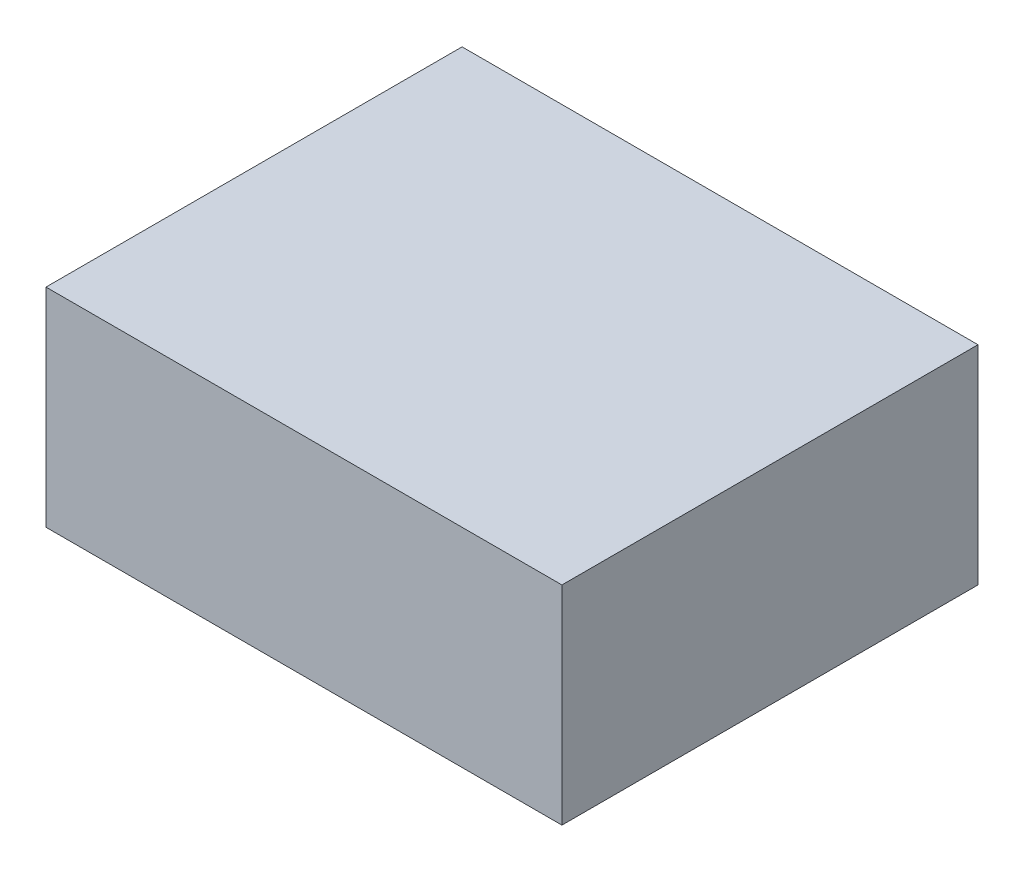
from build123d import *

# Parameters (mm, degrees)
SKETCH_1_W      = 12.4
SKETCH_1_H      = 5
EXTRUDE_1_DEPTH = 10


with BuildPart() as part:
    # 草图1 → 凸台-拉伸1 (new body)
    with BuildSketch(Plane.XY):
        Rectangle(SKETCH_1_W, SKETCH_1_H)
    extrude(amount=EXTRUDE_1_DEPTH)


solid = part.part
